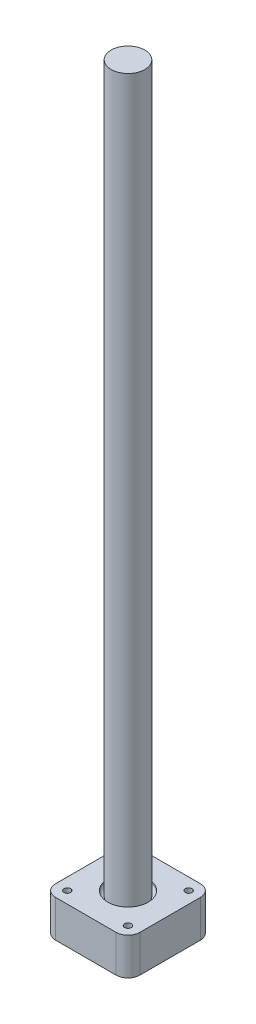
from build123d import *

# Parameters (mm, degrees)
SKETCH1_W           = 50
SKETCH1_H           = 50
BOSS_EXTRUDE1_DEPTH = 22
FILLET1_R           = 7
SKETCH2_R           = 2
CUT_EXTRUDE1_DEPTH  = 22
SKETCH3_R           = 12
CUT_EXTRUDE2_DEPTH  = 3
FILLET2_R           = 2
SKETCH4_R           = 10
BOSS_EXTRUDE2_DEPTH = 430


with BuildPart() as part:
    # Sketch1 → Boss-Extrude1 (new body)
    with BuildSketch(Plane(origin=(0, 0, 0), x_dir=(1, 0, 0), z_dir=(0, 1, 0))):
        with Locations((25, -25)):
            Rectangle(SKETCH1_W, SKETCH1_H)
    extrude(amount=BOSS_EXTRUDE1_DEPTH)

    # Fillet1
    fillet1_edges = [part.edges().sort_by_distance(p)[0] for p in [
        (50, 11, 0),
        (50, 11, 50),
        (0, 11, 50),
        (0, 11, 0),
    ]]
    fillet(fillet1_edges, radius=FILLET1_R)

    # Sketch2 → Cut-Extrude1 (cut)
    with BuildSketch(Plane(origin=(0, 22, 0), x_dir=(1, 0, 0), z_dir=(0, 1, 0))):
        with Locations(Location((7, -7, 0), (0, 0, 270))):
            Circle(SKETCH2_R)
        with Locations(Location((7, -43, 0), (0, 0, 270))):
            Circle(SKETCH2_R)
        with Locations(Location((43, -43, 0), (0, 0, 270))):
            Circle(SKETCH2_R)
        with Locations(Location((43, -7, 0), (0, 0, 270))):
            Circle(SKETCH2_R)
    extrude(amount=-CUT_EXTRUDE1_DEPTH, mode=Mode.SUBTRACT)

    # Sketch3 → Cut-Extrude2 (cut)
    with BuildSketch(Plane(origin=(0, 22, 0), x_dir=(1, 0, 0), z_dir=(0, 1, 0))):
        with Locations(Location((25, -25, 0), (0, 0, 270))):
            Circle(SKETCH3_R)
    extrude(amount=-CUT_EXTRUDE2_DEPTH, mode=Mode.SUBTRACT)

    # Fillet2
    fillet2_edges = [part.edges().sort_by_distance(p)[0] for p in [
        (25, 19, 13),
    ]]
    fillet(fillet2_edges, radius=FILLET2_R)

    # Sketch4 → Boss-Extrude2 (add)
    with BuildSketch(Plane(origin=(0, 19, 0), x_dir=(1, 0, 0), z_dir=(0, 1, 0))):
        with Locations(Location((25, -25, 0), (0, 0, 270))):
            Circle(SKETCH4_R)
    extrude(amount=BOSS_EXTRUDE2_DEPTH)


solid = part.part
